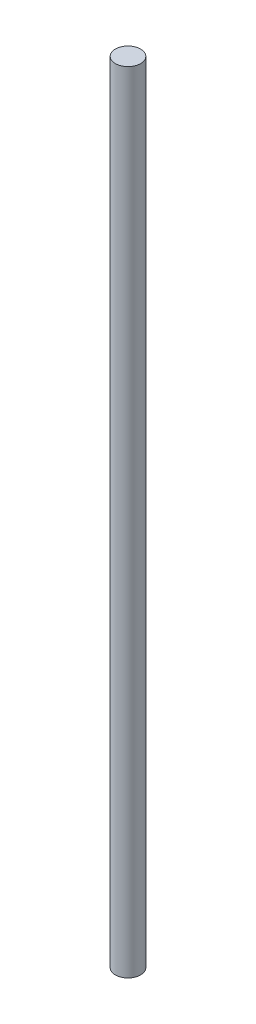
from build123d import *

# Parameters (mm, degrees)
SKETCH1_R           = 3.175
BOSS_EXTRUDE1_DEPTH = 198.57


with BuildPart() as part:
    # Sketch1 → Boss-Extrude1 (new body)
    with BuildSketch(Plane(origin=(0, 0, 0), x_dir=(1, 0, 0), z_dir=(0, 1, 0))):
        with Locations(Location((0, 0, 0), (0, 0, 270))):
            Circle(SKETCH1_R)
    extrude(amount=BOSS_EXTRUDE1_DEPTH)


solid = part.part
